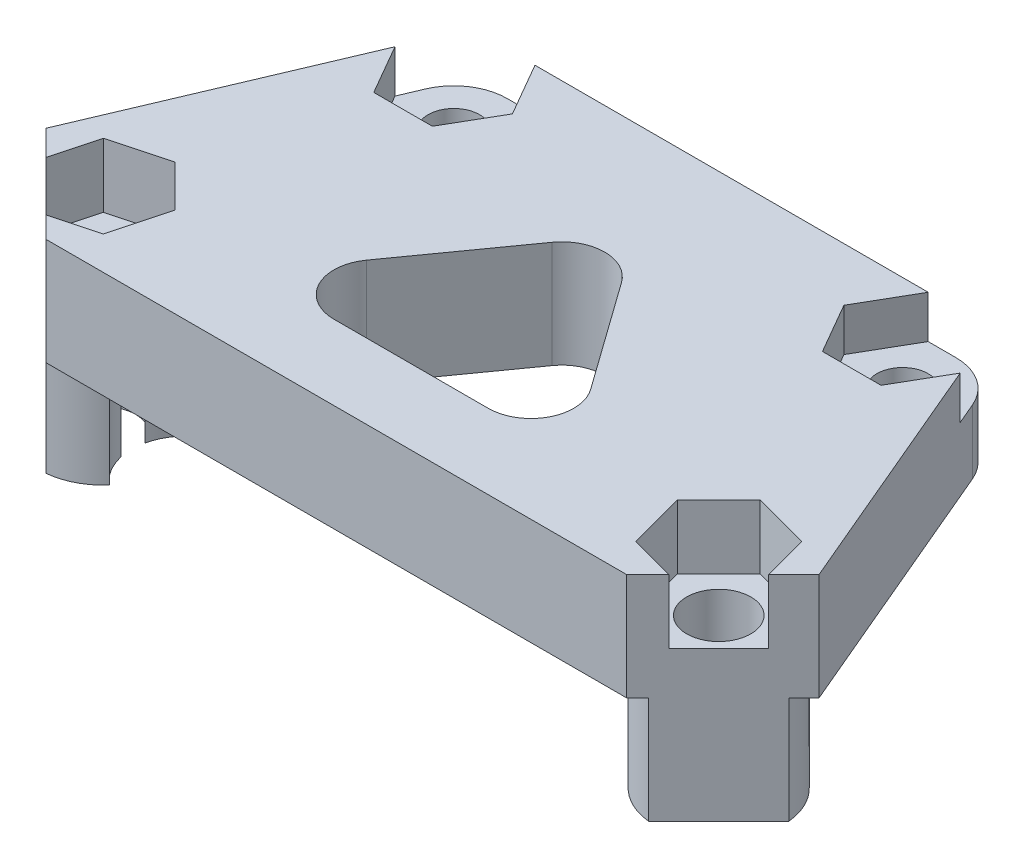
from build123d import *

# Parameters (mm, degrees)
SKETCH1_R            = 1.5
SKETCH1_R_2          = 2.5
BOSS_EXTRUDE1_DEPTH  = 5
M2_CLEARANCE_HOLE1_D = 2.4
FILLET1_R            = 2
BOSS_EXTRUDE2_START  = 5
BOSS_EXTRUDE2_DEPTH  = 5
CUT_EXTRUDE1_START   = -3
SKETCH5_R            = 1.5
CUT_EXTRUDE1_DEPTH   = 3
CUT_EXTRUDE2_START   = -2
SKETCH6_R            = 1.2
CUT_EXTRUDE2_DEPTH   = 2


with BuildPart() as part:
    # Sketch1 → Boss-Extrude1 (new body)
    # profile 1 of 3: a face of its own
    with BuildSketch(Plane(origin=(0, 0, 0), x_dir=(1, 0, 0), z_dir=(0, 1, 0))):
        with BuildLine():
            Line((10.5, 2.5), (-10.5, 2.5))
            ThreePointArc((-10.5, 2.5), (-8.732233047, 1.767766953), (-8, 0))
            ThreePointArc((-8, 0), (-10.997961344, -2.449904998), (-12.8016276, 0.975966388))
            Line((-12.8016276, 0.975966388), (-18.090408136, -11.496597633))
            Line((-18.090408136, -11.496597633), (-13.587005769, -16))
            Line((-13.587005769, -16), (13.587005769, -16))
            Line((13.587005769, -16), (18.090408136, -11.496597633))
            Line((18.090408136, -11.496597633), (12.8016276, 0.975966388))
            ThreePointArc((12.8016276, 0.975966388), (12.949904998, 0.497961344), (13, 0))
            ThreePointArc((13, 0), (8.732233047, -1.767766953), (10.5, 2.5))
        make_face()
        with Locations(Location((-14.4, -12.5, 0), (0, 0, 270))):
            Circle(SKETCH1_R, mode=Mode.SUBTRACT)
        with Locations(Location((14.4, -12.5, 0), (0, 0, 270))):
            Circle(SKETCH1_R, mode=Mode.SUBTRACT)
        Polygon((-7.5, -12.5), (0, -2), (7.5, -12.5), align=None, mode=Mode.SUBTRACT)
    # profile 2 of 3: a face of its own
    with BuildSketch(Plane(origin=(0, 0, 0), x_dir=(1, 0, 0), z_dir=(0, 1, 0))):
        with Locations((-10.5, 0)):
            Circle(SKETCH1_R_2)
    # profile 3 of 3: a face of its own
    with BuildSketch(Plane(origin=(0, 0, 0), x_dir=(1, 0, 0), z_dir=(0, 1, 0))):
        with Locations((10.5, 0)):
            Circle(SKETCH1_R_2)
    extrude(amount=BOSS_EXTRUDE1_DEPTH)

    # M2 Clearance Hole1 (through all)
    with Locations(Plane(origin=(0, 5, 0), x_dir=(1, 0, 0), z_dir=(0, 1, 0))):
        with Locations((-10.5, 0), (10.5, 0)):
            Hole(M2_CLEARANCE_HOLE1_D / 2)

    # Fillet1
    fillet1_edges = [part.edges().sort_by_distance(p)[0] for p in [
        (0, 2.5, 2),
        (-7.5, 2.5, 12.5),
        (7.5, 2.5, 12.5),
    ]]
    fillet(fillet1_edges, radius=FILLET1_R)

    # Sketch4 → Boss-Extrude2 (add)
    with BuildSketch(Plane.XZ.offset(BOSS_EXTRUDE2_START)):
        with BuildLine():
            Line((-14.101857368, 15.4851484), (-17.3851484, 12.201857368))
            ThreePointArc((-17.3851484, 12.201857368), (-15.317017203, 9.643589762), (-12.146233974, 10.519964975))
            ThreePointArc((-12.146233974, 10.519964975), (-12.695571974, 11.154604627), (-13.01161859, 11.932199807))
            ThreePointArc((-13.01161859, 11.932199807), (-15.9, 12.5), (-13.01161859, 13.067800193))
            ThreePointArc((-13.01161859, 13.067800193), (-12.695571974, 13.845395373), (-12.146233974, 14.480035025))
            ThreePointArc((-12.146233974, 14.480035025), (-13.028642033, 15.168216132), (-14.101857368, 15.4851484))
        make_face()
        with BuildLine():
            ThreePointArc((12.146233974, 10.519964975), (15.317017203, 9.643589762), (17.3851484, 12.201857368))
            Line((17.3851484, 12.201857368), (14.101857368, 15.4851484))
            ThreePointArc((14.101857368, 15.4851484), (13.028642033, 15.168216132), (12.146233974, 14.480035025))
            ThreePointArc((12.146233974, 14.480035025), (12.695571974, 13.845395373), (13.01161859, 13.067800193))
            ThreePointArc((13.01161859, 13.067800193), (15.9, 12.5), (13.01161859, 11.932199807))
            ThreePointArc((13.01161859, 11.932199807), (12.695571974, 11.154604627), (12.146233974, 10.519964975))
        make_face()
    extrude(amount=-BOSS_EXTRUDE2_DEPTH)

    # Sketch5 → Cut-Extrude1 (cut)
    # profile 1 of 2: a face of its own
    with BuildSketch(Plane(origin=(0, 5, 0), x_dir=(1, 0, 0), z_dir=(0, 1, 0)).offset(CUT_EXTRUDE1_START)):
        Polygon((15.109788915, -15.148968295), (17.048968295, -13.209788915), (16.33917938, -10.56082062), (13.690211085, -9.851031705), (11.751031705, -11.790211085), (12.46082062, -14.43917938), align=None)
        with Locations(Location((14.4, -12.5, 0), (0, 0, 157.757128517))):
            Circle(SKETCH5_R, mode=Mode.SUBTRACT)
    # profile 2 of 2: a face of its own
    with BuildSketch(Plane(origin=(0, 5, 0), x_dir=(1, 0, 0), z_dir=(0, 1, 0)).offset(CUT_EXTRUDE1_START)):
        Polygon((-12.46082062, -14.43917938), (-15.109788915, -15.148968295), (-17.048968295, -13.209788915), (-16.33917938, -10.56082062), (-13.690211085, -9.851031705), (-11.751031705, -11.790211085), align=None)
    extrude(amount=CUT_EXTRUDE1_DEPTH, mode=Mode.SUBTRACT)

    # Sketch6 → Cut-Extrude2 (cut)
    # profile 1 of 6: a face of its own
    with BuildSketch(Plane(origin=(0, 5, 0), x_dir=(1, 0, 0), z_dir=(0, 1, 0)).offset(CUT_EXTRUDE2_START)):
        with BuildLine():
            Line((-7.757586221, 0), (-9.128793111, 2.375))
            Line((-9.128793111, 2.375), (-11.28062475, 2.375))
            ThreePointArc((-11.28062475, 2.375), (-11.75, 2.165063509), (-12.166497959, 1.863540864))
            Line((-12.166497959, 1.863540864), (-13.140949749, 0.175740855))
            Line((-13.140949749, 0.175740855), (-13.226879096, -0.026906859))
            Line((-13.226879096, -0.026906859), (-11.871206889, -2.375))
            Line((-11.871206889, -2.375), (-9.128793111, -2.375))
            Line((-9.128793111, -2.375), (-7.757586221, 0))
        make_face()
        with Locations(Location((-10.5, 0, 0), (0, 0, 270))):
            Circle(SKETCH6_R, mode=Mode.SUBTRACT)
    # profile 2 of 6: a face of its own
    with BuildSketch(Plane(origin=(0, 5, 0), x_dir=(1, 0, 0), z_dir=(0, 1, 0)).offset(CUT_EXTRUDE2_START)):
        with BuildLine():
            Line((-13.140949749, 0.175740855), (-12.166497959, 1.863540864))
            ThreePointArc((-12.166497959, 1.863540864), (-12.533089331, 1.454835995), (-12.8016276, 0.975966388))
            Line((-12.8016276, 0.975966388), (-13.140949749, 0.175740855))
        make_face()
    # profile 3 of 6: a face of its own
    with BuildSketch(Plane(origin=(0, 5, 0), x_dir=(1, 0, 0), z_dir=(0, 1, 0)).offset(CUT_EXTRUDE2_START)):
        with BuildLine():
            Line((-9.128793111, 2.375), (-9.200961894, 2.5))
            Line((-9.200961894, 2.5), (-10.5, 2.5))
            ThreePointArc((-10.5, 2.5), (-10.895284708, 2.468552207), (-11.28062475, 2.375))
            Line((-11.28062475, 2.375), (-9.128793111, 2.375))
        make_face()
    # profile 4 of 6: a face of its own
    with BuildSketch(Plane(origin=(0, 5, 0), x_dir=(1, 0, 0), z_dir=(0, 1, 0)).offset(CUT_EXTRUDE2_START)):
        with BuildLine():
            Line((7.757586221, 0), (9.128793111, -2.375))
            Line((9.128793111, -2.375), (11.871206889, -2.375))
            Line((11.871206889, -2.375), (13.226879096, -0.026906859))
            Line((13.226879096, -0.026906859), (13.140949749, 0.175740855))
            Line((13.140949749, 0.175740855), (12.166497959, 1.863540864))
            ThreePointArc((12.166497959, 1.863540864), (11.75, 2.165063509), (11.28062475, 2.375))
            Line((11.28062475, 2.375), (9.128793111, 2.375))
            Line((9.128793111, 2.375), (7.757586221, 0))
        make_face()
        with Locations(Location((10.5, 0, 0), (0, 0, 270))):
            Circle(SKETCH6_R, mode=Mode.SUBTRACT)
    # profile 5 of 6: a face of its own
    with BuildSketch(Plane(origin=(0, 5, 0), x_dir=(1, 0, 0), z_dir=(0, 1, 0)).offset(CUT_EXTRUDE2_START)):
        with BuildLine():
            Line((12.166497959, 1.863540864), (13.140949749, 0.175740855))
            Line((13.140949749, 0.175740855), (12.8016276, 0.975966388))
            ThreePointArc((12.8016276, 0.975966388), (12.533089331, 1.454835995), (12.166497959, 1.863540864))
        make_face()
    # profile 6 of 6: a face of its own
    with BuildSketch(Plane(origin=(0, 5, 0), x_dir=(1, 0, 0), z_dir=(0, 1, 0)).offset(CUT_EXTRUDE2_START)):
        with BuildLine():
            Line((9.200961894, 2.5), (9.128793111, 2.375))
            Line((9.128793111, 2.375), (11.28062475, 2.375))
            ThreePointArc((11.28062475, 2.375), (10.895284708, 2.468552207), (10.5, 2.5))
            Line((10.5, 2.5), (9.200961894, 2.5))
        make_face()
    extrude(amount=CUT_EXTRUDE2_DEPTH, mode=Mode.SUBTRACT)


solid = part.part
